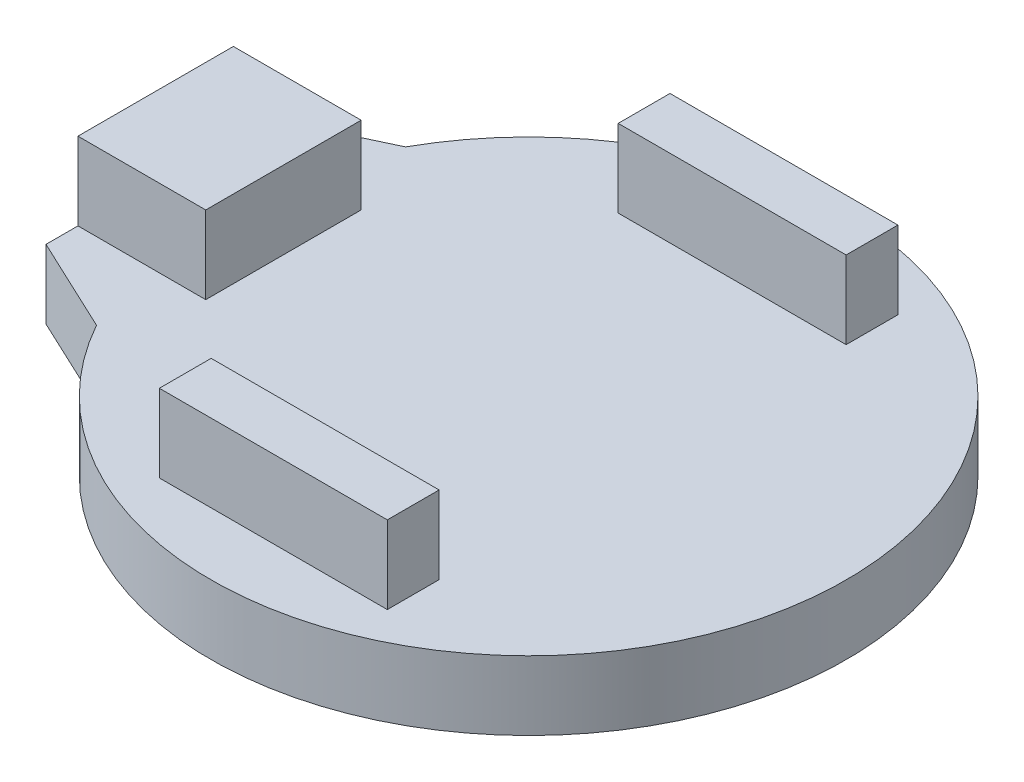
from build123d import *

# Parameters (mm, degrees)
BOSS_EXTRUDE1_DEPTH = 4
SKETCH2_W           = 13.2
SKETCH2_H           = 3
SKETCH2_W_2         = 7.4
SKETCH2_H_2         = 9
BOSS_EXTRUDE2_DEPTH = 4.5


with BuildPart() as part:
    # Sketch1 → Boss-Extrude1 (new body)
    with BuildSketch(Plane(origin=(0, 0, 0), x_dir=(1, 0, 0), z_dir=(0, 1, 0))):
        with BuildLine():
            Line((-21.6, -6.35), (-21.6, 6.35))
            Line((-21.6, 6.35), (-16.079449671, 8.94490348))
            ThreePointArc((-16.079449671, 8.94490348), (18.4, 0), (-16.079449671, -8.94490348))
            Line((-16.079449671, -8.94490348), (-21.6, -6.35))
        make_face()
    extrude(amount=BOSS_EXTRUDE1_DEPTH)

    # Sketch2 → Boss-Extrude2 (add)
    with BuildSketch(Plane(origin=(0, 4, 0), x_dir=(1, 0, 0), z_dir=(0, 1, 0))):
        with Locations((0, 13.285)):
            Rectangle(SKETCH2_W, SKETCH2_H)
        with Locations((0, -13.285)):
            Rectangle(SKETCH2_W, SKETCH2_H)
        with Locations((-17.9, 0)):
            Rectangle(SKETCH2_W_2, SKETCH2_H_2)
    extrude(amount=BOSS_EXTRUDE2_DEPTH)


solid = part.part
